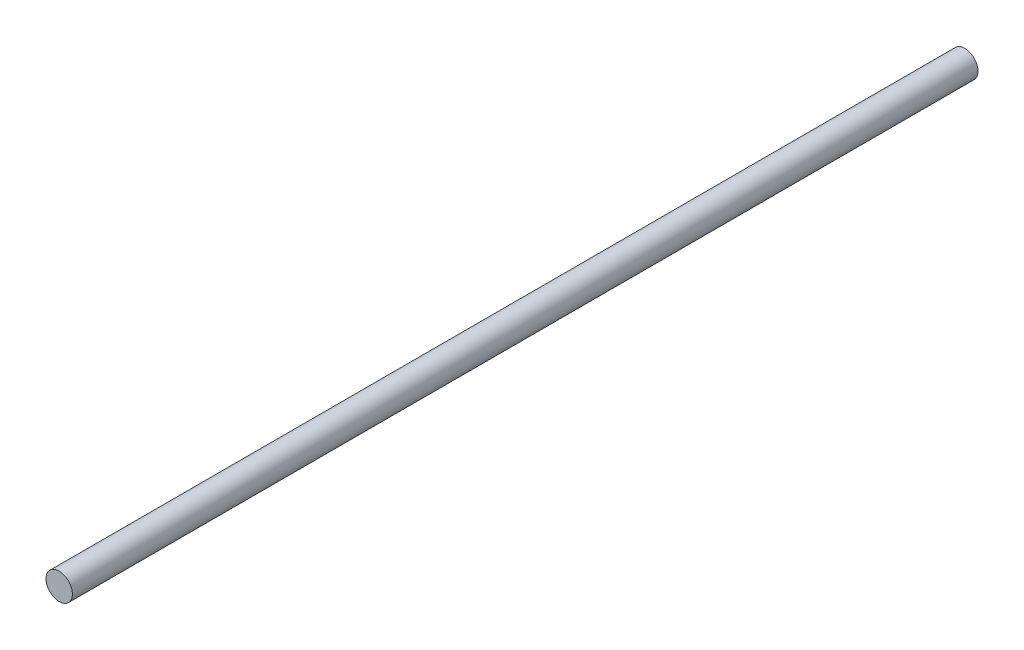
from build123d import *

# Parameters (mm, degrees)
SKETCH1_R           = 3.5
BOSS_EXTRUDE1_DEPTH = 240


with BuildPart() as part:
    # Sketch1 → Boss-Extrude1 (new body)
    with BuildSketch(Plane.XY):
        Circle(SKETCH1_R)
    extrude(amount=BOSS_EXTRUDE1_DEPTH)


solid = part.part
